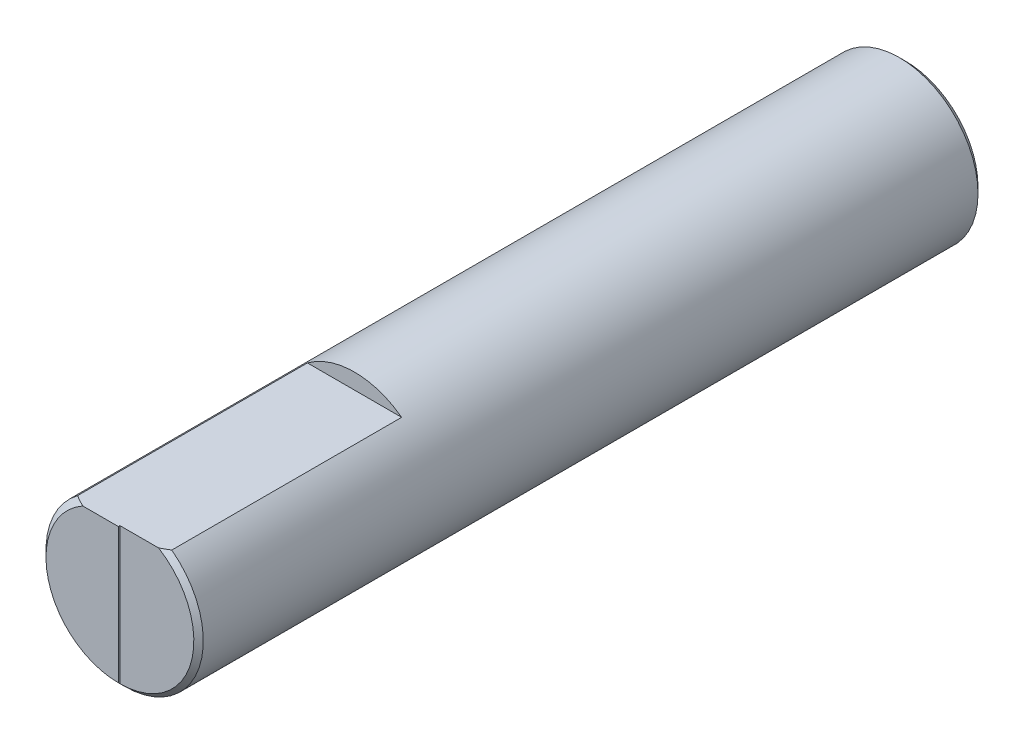
from build123d import *

# Parameters (mm, degrees)
SKETCH1_R                     = 6.34365
MAIN_SHAFTBOSS_EXTRUDE1_DEPTH = 63.5
SKETCH2_W                     = 9.398
SKETCH2_H                     = 3.175
SHAFT_FLATCUT_EXTRUDE1_DEPTH  = 19.05
CHAMFER1_SIZE                 = 0.508
SKETCH3_W                     = 7.358407373
SKETCH3_H                     = 13.78482206
FACETARGETCUT_EXTRUDE2_DEPTH  = 0.127


with BuildPart() as part:
    # Sketch1 → Main ShaftBoss-Extrude1 (new body)
    with BuildSketch(Plane.XY):
        Circle(SKETCH1_R)
    extrude(amount=MAIN_SHAFTBOSS_EXTRUDE1_DEPTH)

    # Sketch2 → Shaft FlatCut-Extrude1 (cut)
    with BuildSketch(Plane.XY.offset(63.5)):
        with Locations((0, 6.6675)):
            Rectangle(SKETCH2_W, SKETCH2_H)
    extrude(amount=-SHAFT_FLATCUT_EXTRUDE1_DEPTH, mode=Mode.SUBTRACT)

    # Chamfer1
    chamfer1_edges = [part.edges().sort_by_distance(p)[0] for p in [
        (-6.34365, 0, 0),
        (-2.840755677, -5.672036892, 63.5),
    ]]
    chamfer(chamfer1_edges, length=CHAMFER1_SIZE)

    # Sketch3 → FaceTargetCut-Extrude2 (cut)
    with BuildSketch(Plane.XY.offset(63.5)):
        with Locations((3.679203687, -0.119208367)):
            Rectangle(SKETCH3_W, SKETCH3_H)
    extrude(amount=-FACETARGETCUT_EXTRUDE2_DEPTH, mode=Mode.SUBTRACT)


solid = part.part
